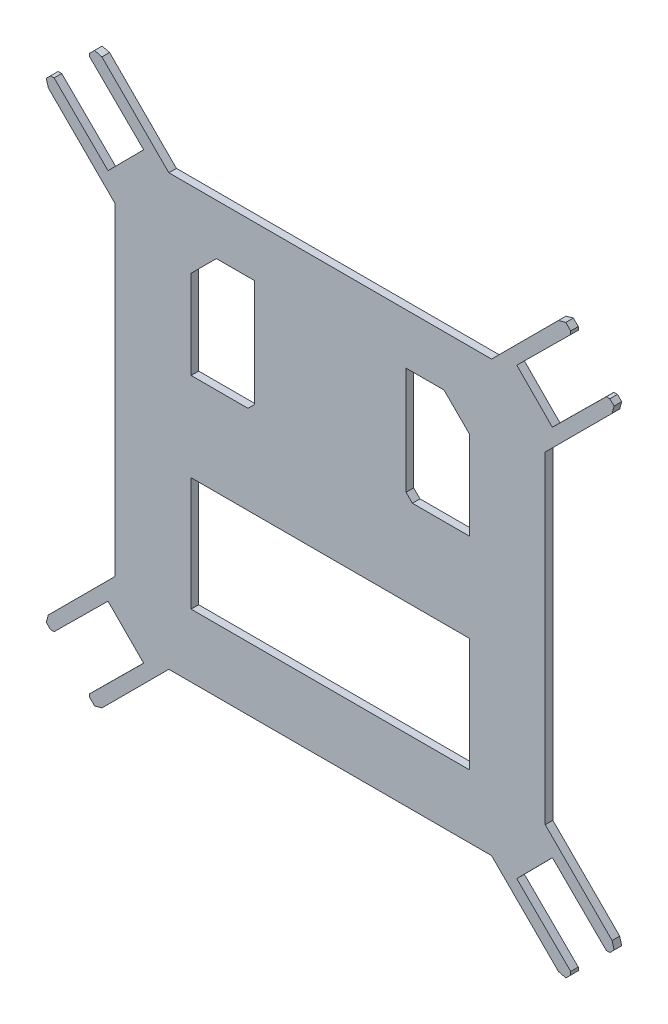
from build123d import *

# Parameters (mm, degrees)
BOSS_EXTRUDE1_DEPTH = 3
SKETCH2_W           = 109.999996871
SKETCH2_H           = 44.999998436
CUT_EXTRUDE1_DEPTH  = 10


with BuildPart() as part:
    # Sketch1 → Boss-Extrude1 (new body)
    with BuildSketch(Plane.XY):
        Polygon((158.754970941, -72.897106565), (180.070576123, -94.00741153), (180.070576123, -95.284756679), (178.131724855, -97.223607947), (175.233947376, -96.447150811), (148.786793436, -69.999996871), (21.213203436, -69.999996871), (-5.233950505, -96.447150811), (-8.131727984, -97.223607947), (-10.070579252, -95.284756679), (-10.070579252, -94.00741153), (11.24502593, -72.897106565), (-2.828675487, -58.686536734), (-24.144280669, -79.796841699), (-25.558494231, -79.796841699), (-27.223611076, -78.131724855), (-26.44715394, -75.233947376), (0, -48.786793435), (0, 78.786796565), (-26.44715394, 105.233950505), (-27.223611076, 108.131727984), (-25.558494231, 109.796844828), (-24.144280669, 109.796844828), (-2.828675487, 88.686539863), (11.24502593, 102.897109694), (-10.070579252, 124.007414659), (-10.070579252, 125.284759808), (-8.131727984, 127.223611076), (-5.233950505, 126.447153941), (21.213203436, 100), (148.786793436, 100), (175.233947376, 126.447153941), (178.131724855, 127.223611076), (180.070576123, 125.284759808), (180.070576123, 124.007414659), (158.754970941, 102.897109694), (172.828672358, 88.686539863), (194.14427754, 109.796844828), (195.558491102, 109.796844828), (197.223607947, 108.131727984), (196.447150812, 105.233950505), (169.999996871, 78.786796565), (169.999996871, -48.786793435), (196.447150812, -75.233947376), (197.223607947, -78.131724855), (195.558491102, -79.796841699), (194.14427754, -79.796841699), (172.828672358, -58.686536734), align=None)
    extrude(amount=BOSS_EXTRUDE1_DEPTH)

    # Sketch2 → Cut-Extrude1 (cut)
    with BuildSketch(Plane.XY.offset(3)):
        Polygon((30, 70), (40, 80), (54.999998436, 80), (54.999998436, 37.500001565), (52.499998436, 35.000001565), (30, 35.000001565), align=None)
        Polygon((139.999996871, 35.000001565), (117.499998436, 35.000001565), (114.999998436, 37.500001565), (114.999998436, 80), (129.999996871, 80), (139.999996871, 70), align=None)
        with Locations((84.999998436, -22.499997653)):
            Rectangle(SKETCH2_W, SKETCH2_H)
    extrude(amount=-CUT_EXTRUDE1_DEPTH, mode=Mode.SUBTRACT)


solid = part.part
